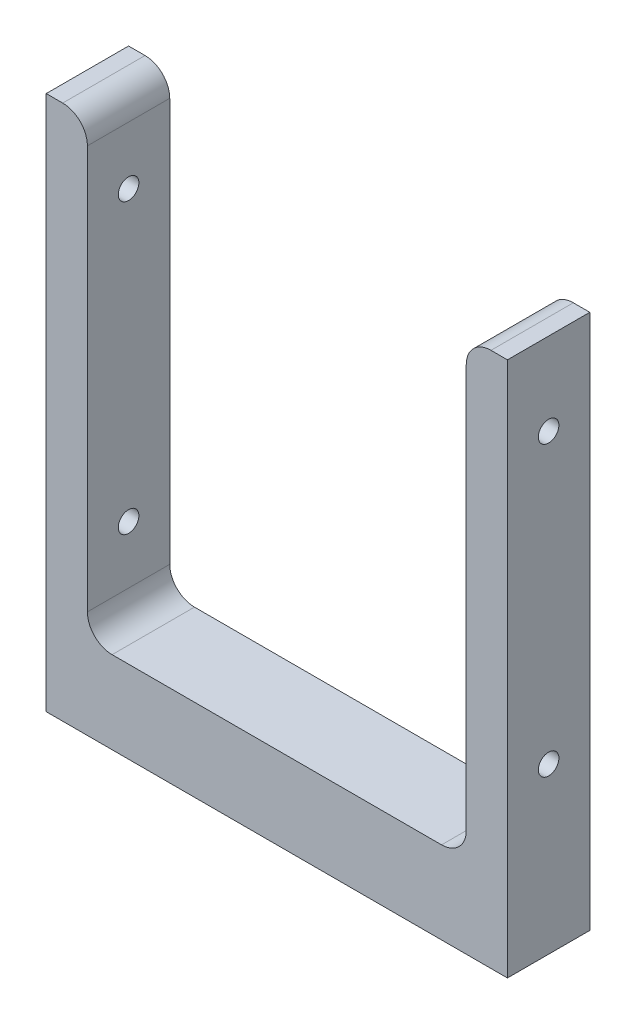
from build123d import *

# Parameters (mm, degrees)
EXTRUDE_1_DEPTH = 10
FILLET_1_R      = 3
M3X0_52_D       = 2.5


with BuildPart() as part:
    # Эскиз1 → Бобышка-Вытянуть1 (new body)
    with BuildSketch(Plane.XY):
        Polygon((28, 32.5), (23, 32.5), (23, -22.5), (-23, -22.5), (-23, 32.5), (-28, 32.5), (-28, -32.5), (28, -32.5), align=None)
    extrude(amount=EXTRUDE_1_DEPTH)

    # Скругление1
    fillet_1_edges = [part.edges().sort_by_distance(p)[0] for p in [
        (-23, 32.5, 5),
        (-23, -22.5, 5),
        (23, -22.5, 5),
        (23, 32.5, 5),
    ]]
    fillet(fillet_1_edges, radius=FILLET_1_R)

    # Отверстие обработанное метчиком M3x0.52 (through all)
    with Locations(Plane(origin=(28, 0, 0), x_dir=(0, 0, -1), z_dir=(1, 0, 0))):
        with Locations((-5, 22.5), (-5, -12.5)):
            Hole(M3X0_52_D / 2)


solid = part.part
